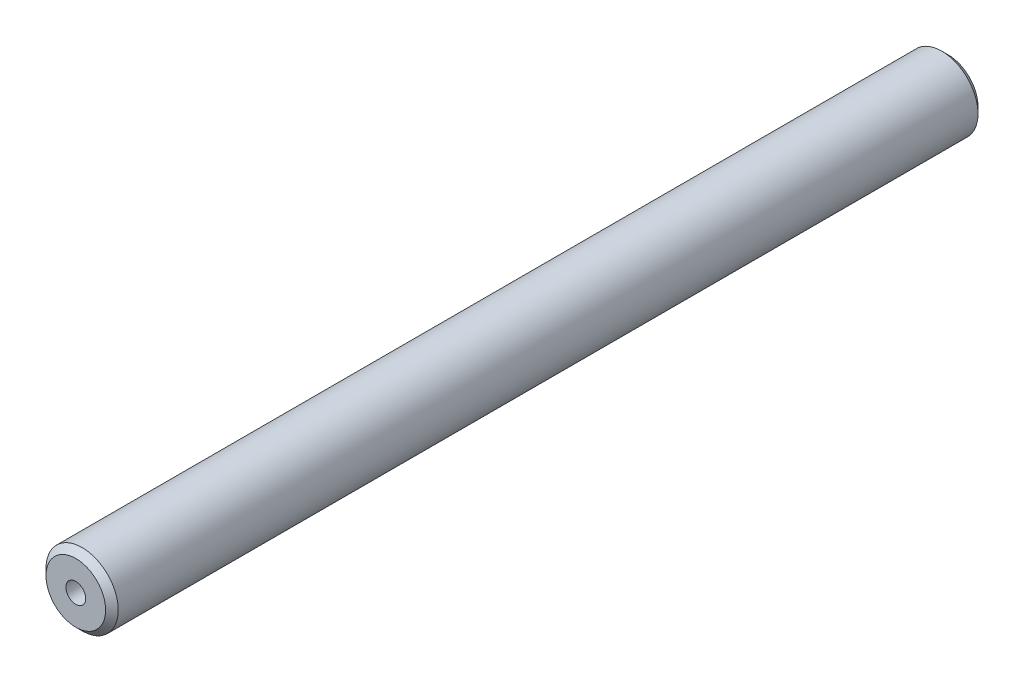
from build123d import *

# Parameters (mm, degrees)
IZIM1_R                     = 4
Y_KSEKLIK_EKSTR_ZYON1_DEPTH = 96.6
IZIM3_R                     = 1.1
KES_EKSTR_ZYON2_DEPTH       = 25
PAH1_SIZE                   = 0.7
PAH2_SIZE                   = 0.7


with BuildPart() as part:
    # Çizim1 → Yükseklik-Ekstrüzyon1 (new body)
    with BuildSketch(Plane.XY):
        with Locations(Location((0, 0, 0), (0, 0, 180))):
            Circle(IZIM1_R)
    extrude(amount=Y_KSEKLIK_EKSTR_ZYON1_DEPTH)

    # Çizim3 → Kes-Ekstrüzyon2 (cut)
    with BuildSketch(Plane.XY.offset(96.6)):
        Circle(IZIM3_R)
    extrude(amount=-KES_EKSTR_ZYON2_DEPTH, mode=Mode.SUBTRACT)

    # Pah1
    pah1_edges = [part.edges().sort_by_distance(p)[0] for p in [
        (4, 0, 96.6),
    ]]
    chamfer(pah1_edges, length=PAH1_SIZE)

    # Pah2
    pah2_edges = [part.edges().sort_by_distance(p)[0] for p in [
        (4, 0, 0),
    ]]
    chamfer(pah2_edges, length=PAH2_SIZE)


solid = part.part
